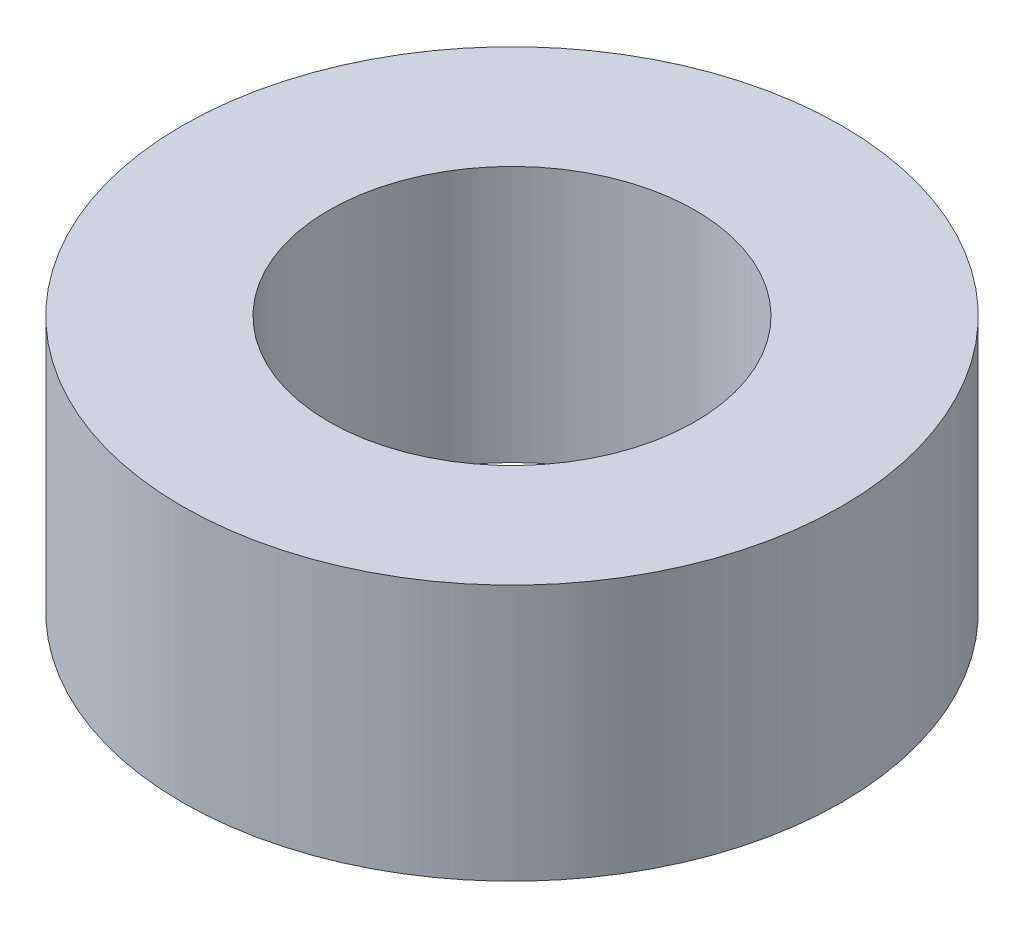
from build123d import *

# Parameters (mm, degrees)
SKETCH1_W = 2
SKETCH1_H = 3.5


with BuildPart() as part:
    # Sketch1 → Revolve1 (revolve)
    with BuildSketch(Plane(origin=(0, 0, 0), x_dir=(0, 0, -1), z_dir=(1, 0, 0)), mode=Mode.PRIVATE) as revolve1_sk:
        with Locations((3.5, 0)):
            Rectangle(SKETCH1_W, SKETCH1_H)
    revolve(revolve1_sk.sketch.rotate(Axis((0, 5.422990698, 0), (0, -1, 0)), 180), axis=Axis((0, 5.422990698, 0), (0, -1, 0)))


solid = part.part
